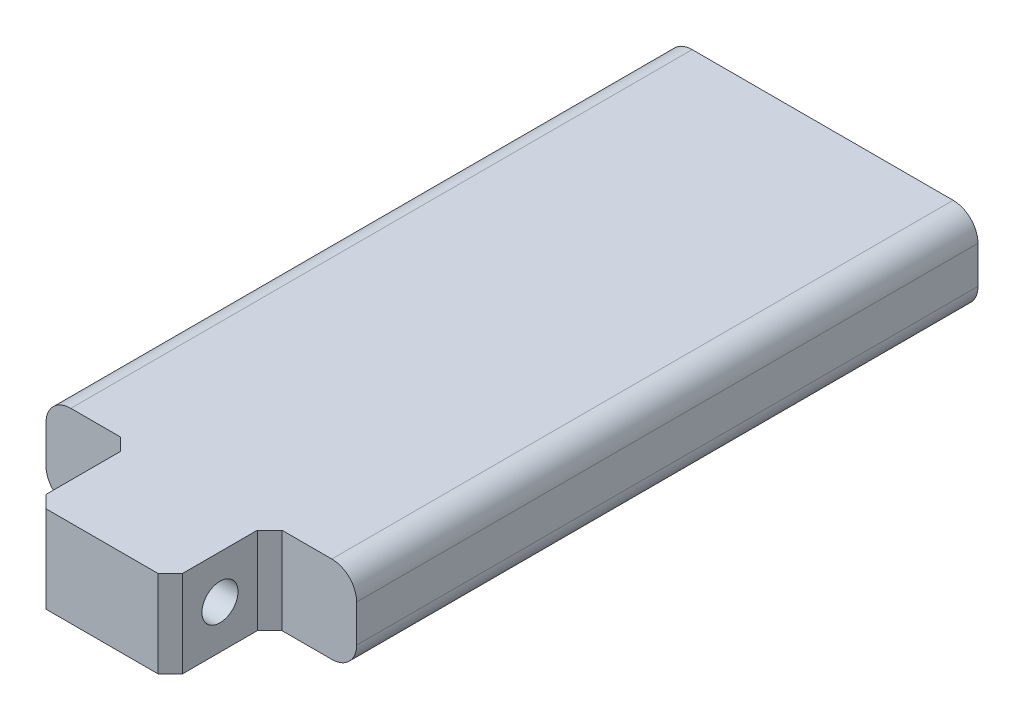
from build123d import *

# Parameters (mm, degrees)
SKETCH1_W                 = 25
SKETCH1_H                 = 7
BOSS_EXTRUDE1_DEPTH       = 58
SKETCH2_W                 = 7
SKETCH2_H                 = 8
CUT_EXTRUDE1_DEPTH        = 60.74320045
M3X0_5_TAPPED_HOLE2_D     = 3
M3X0_5_TAPPED_HOLE2_DEPTH = 7.5
M3X0_5_TAPPED_HOLE2_TIP   = 0.901290929
CHAMFER1_SIZE             = 1
M2_5_CLEARANCE_HOLE1_D    = 2.9
FILLET1_R                 = 2
CHAMFER2_SIZE             = 1


with BuildPart() as part:
    # Sketch1 → Boss-Extrude1 (new body)
    with BuildSketch(Plane.XY):
        Rectangle(SKETCH1_W, SKETCH1_H)
    extrude(amount=BOSS_EXTRUDE1_DEPTH)

    # Sketch2 → Cut-Extrude1 (cut, through all)
    with BuildSketch(Plane(origin=(0, 3.5, 0), x_dir=(1, 0, 0), z_dir=(0, 1, 0))):
        with Locations((-9, -54)):
            Rectangle(SKETCH2_W, SKETCH2_H)
        with Locations((9, -54)):
            Rectangle(SKETCH2_W, SKETCH2_H)
    extrude(amount=-CUT_EXTRUDE1_DEPTH, mode=Mode.SUBTRACT)

    # M3x0.5 Tapped Hole2
    with Locations(Plane(origin=(0, 0, 0), x_dir=(-1, 0, 0), z_dir=(0, 0, -1))):
        with Locations((-7, 0), (7, 0)):
            Hole(M3X0_5_TAPPED_HOLE2_D / 2, depth=M3X0_5_TAPPED_HOLE2_DEPTH)
            with Locations((0, 0, -(M3X0_5_TAPPED_HOLE2_DEPTH + M3X0_5_TAPPED_HOLE2_TIP / 2))):  # 118° drill point
                Cone(0, M3X0_5_TAPPED_HOLE2_D / 2, M3X0_5_TAPPED_HOLE2_TIP, mode=Mode.SUBTRACT)

    # Chamfer1
    chamfer1_edges = [part.edges().sort_by_distance(p)[0] for p in [
        (-5.5, 0, 58),
        (5.5, 0, 58),
    ]]
    chamfer(chamfer1_edges, length=CHAMFER1_SIZE)

    # M2.5 Clearance Hole1 (through all)
    with Locations(Plane(origin=(-5.5, -6.575007997, -1.706532938), x_dir=(0, 0, 1), z_dir=(-1, 0, 0))):
        with Locations((55.706532938, 6.575007997)):
            Hole(M2_5_CLEARANCE_HOLE1_D / 2)

    # Fillet1
    fillet1_edges = [part.edges().sort_by_distance(p)[0] for p in [
        (-12.5, -3.5, 25),
        (-12.5, 3.5, 25),
        (12.5, -3.5, 25),
        (12.5, 3.5, 25),
    ]]
    fillet(fillet1_edges, radius=FILLET1_R)

    # Chamfer2
    chamfer2_edges = [part.edges().sort_by_distance(p)[0] for p in [
        (-5.5, 0, 50),
        (5.5, 0, 50),
    ]]
    chamfer(chamfer2_edges, length=CHAMFER2_SIZE)


solid = part.part
